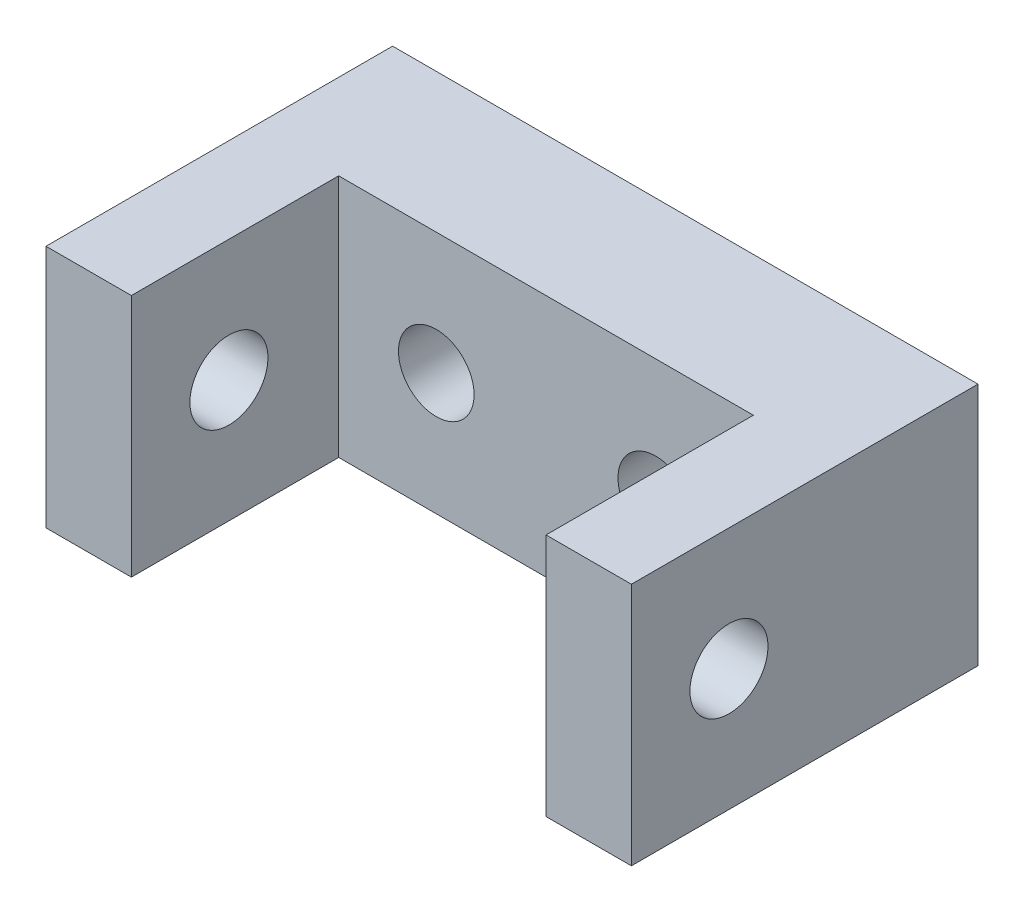
from build123d import *

# Parameters (mm, degrees)
CROQUIS1_W              = 24
CROQUIS1_H              = 10
SALIENTE_EXTRUIR1_DEPTH = 14.21
CROQUIS2_W              = 17
CROQUIS2_H              = 8.5
CORTAR_EXTRUIR1_DEPTH   = 12
CROQUIS3_R              = 1.6
CORTAR_EXTRUIR2_DEPTH   = 29.335915373
CROQUIS4_R              = 1.55
CORTAR_EXTRUIR3_DEPTH   = 12


with BuildPart() as part:
    # Croquis1 → Saliente-Extruir1 (new body)
    with BuildSketch(Plane.XY):
        Rectangle(CROQUIS1_W, CROQUIS1_H)
    extrude(amount=SALIENTE_EXTRUIR1_DEPTH)

    # Croquis2 → Cortar-Extruir1 (cut)
    with BuildSketch(Plane.XZ.offset(5)):
        with Locations((0, 9.96)):
            Rectangle(CROQUIS2_W, CROQUIS2_H)
    extrude(amount=-CORTAR_EXTRUIR1_DEPTH, mode=Mode.SUBTRACT)

    # Croquis3 → Cortar-Extruir2 (cut, through all)
    with BuildSketch(Plane.ZY.offset(12)):
        with Locations((10.21, 0)):
            Circle(CROQUIS3_R)
    extrude(amount=-CORTAR_EXTRUIR2_DEPTH, mode=Mode.SUBTRACT)

    # Croquis4 → Cortar-Extruir3 (cut)
    with BuildSketch(Plane.XY.offset(5.71)):
        with Locations((-4.5, 0)):
            Circle(CROQUIS4_R)
        with Locations((4.5, 0)):
            Circle(CROQUIS4_R)
    extrude(amount=-CORTAR_EXTRUIR3_DEPTH, mode=Mode.SUBTRACT)


solid = part.part
